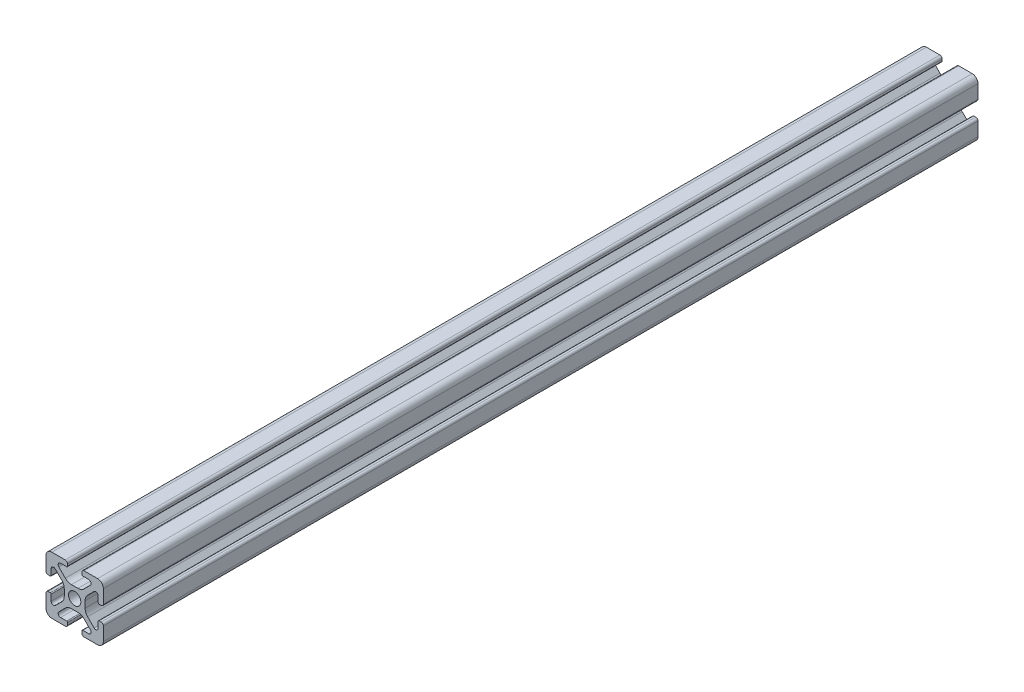
from build123d import *

# Parameters (mm, degrees)
SKETCH1_R           = 2.1463
BOSS_EXTRUDE1_DEPTH = 152.4


with BuildPart() as part:
    # Sketch1 → Boss-Extrude1 (new, symmetric)
    with BuildSketch(Plane.XY):
        with BuildLine():
            Line((-9.9949, 7.9883), (-9.9949, 3.2893))
            ThreePointArc((-9.9949, 3.2893), (-9.76427588, 2.73252412), (-9.2075, 2.5019))
            Line((-9.2075, 2.5019), (-8.4963, 2.5019))
            ThreePointArc((-8.4963, 2.5019), (-8.280773853, 2.591173853), (-8.1915, 2.8067))
            Line((-8.1915, 2.8067), (-8.1915, 4.9149))
            ThreePointArc((-8.1915, 4.9149), (-7.674065253, 5.689295824), (-6.760603096, 5.507596904))
            Line((-6.760603096, 5.507596904), (-4.505765747, 3.252759555))
            ThreePointArc((-4.505765747, 3.252759555), (-3.856054457, 2.280397894), (-3.627906192, 1.133419111))
            Line((-3.627906192, 1.133419111), (-3.627906192, -1.133419111))
            ThreePointArc((-3.627906192, -1.133419111), (-3.856054457, -2.280397894), (-4.505765747, -3.252759555))
            Line((-4.505765747, -3.252759555), (-6.760603096, -5.507596904))
            ThreePointArc((-6.760603096, -5.507596904), (-7.674065253, -5.689295824), (-8.1915, -4.9149))
            Line((-8.1915, -4.9149), (-8.1915, -2.8067))
            ThreePointArc((-8.1915, -2.8067), (-8.280773853, -2.591173853), (-8.4963, -2.5019))
            Line((-8.4963, -2.5019), (-9.2075, -2.5019))
            ThreePointArc((-9.2075, -2.5019), (-9.76427588, -2.73252412), (-9.9949, -3.2893))
            Line((-9.9949, -3.2893), (-9.9949, -7.9883))
            ThreePointArc((-9.9949, -7.9883), (-9.407180467, -9.407180467), (-7.9883, -9.9949))
            Line((-7.9883, -9.9949), (-3.2893, -9.9949))
            ThreePointArc((-3.2893, -9.9949), (-2.73252412, -9.76427588), (-2.5019, -9.2075))
            Line((-2.5019, -9.2075), (-2.5019, -8.4963))
            ThreePointArc((-2.5019, -8.4963), (-2.591173853, -8.280773853), (-2.8067, -8.1915))
            Line((-2.8067, -8.1915), (-4.9149, -8.1915))
            ThreePointArc((-4.9149, -8.1915), (-5.689295824, -7.674065253), (-5.507596904, -6.760603096))
            Line((-5.507596904, -6.760603096), (-3.252759555, -4.505765747))
            ThreePointArc((-3.252759555, -4.505765747), (-2.280397894, -3.856054457), (-1.133419111, -3.627906192))
            Line((-1.133419111, -3.627906192), (1.133419111, -3.627906192))
            ThreePointArc((1.133419111, -3.627906192), (2.280397894, -3.856054457), (3.252759555, -4.505765747))
            Line((3.252759555, -4.505765747), (5.507596904, -6.760603096))
            ThreePointArc((5.507596904, -6.760603096), (5.689295824, -7.674065253), (4.9149, -8.1915))
            Line((4.9149, -8.1915), (2.8067, -8.1915))
            ThreePointArc((2.8067, -8.1915), (2.591173853, -8.280773853), (2.5019, -8.4963))
            Line((2.5019, -8.4963), (2.5019, -9.2075))
            ThreePointArc((2.5019, -9.2075), (2.73252412, -9.76427588), (3.2893, -9.9949))
            Line((3.2893, -9.9949), (7.9883, -9.9949))
            ThreePointArc((7.9883, -9.9949), (9.407180467, -9.407180467), (9.9949, -7.9883))
            Line((9.9949, -7.9883), (9.9949, -3.2893))
            ThreePointArc((9.9949, -3.2893), (9.76427588, -2.73252412), (9.2075, -2.5019))
            Line((9.2075, -2.5019), (8.4963, -2.5019))
            ThreePointArc((8.4963, -2.5019), (8.280773853, -2.591173853), (8.1915, -2.8067))
            Line((8.1915, -2.8067), (8.1915, -4.9149))
            ThreePointArc((8.1915, -4.9149), (7.674065253, -5.689295824), (6.760603096, -5.507596904))
            Line((6.760603096, -5.507596904), (4.505765747, -3.252759555))
            ThreePointArc((4.505765747, -3.252759555), (3.856054457, -2.280397894), (3.627906192, -1.133419111))
            Line((3.627906192, -1.133419111), (3.627906192, 1.133419111))
            ThreePointArc((3.627906192, 1.133419111), (3.856054457, 2.280397894), (4.505765747, 3.252759555))
            Line((4.505765747, 3.252759555), (6.760603096, 5.507596904))
            ThreePointArc((6.760603096, 5.507596904), (7.674065253, 5.689295824), (8.1915, 4.9149))
            Line((8.1915, 4.9149), (8.1915, 2.8067))
            ThreePointArc((8.1915, 2.8067), (8.280773853, 2.591173853), (8.4963, 2.5019))
            Line((8.4963, 2.5019), (9.2075, 2.5019))
            ThreePointArc((9.2075, 2.5019), (9.76427588, 2.73252412), (9.9949, 3.2893))
            Line((9.9949, 3.2893), (9.9949, 7.9883))
            ThreePointArc((9.9949, 7.9883), (9.407180467, 9.407180467), (7.9883, 9.9949))
            Line((7.9883, 9.9949), (3.2893, 9.9949))
            ThreePointArc((3.2893, 9.9949), (2.73252412, 9.76427588), (2.5019, 9.2075))
            Line((2.5019, 9.2075), (2.5019, 8.4963))
            ThreePointArc((2.5019, 8.4963), (2.591173853, 8.280773853), (2.8067, 8.1915))
            Line((2.8067, 8.1915), (4.9149, 8.1915))
            ThreePointArc((4.9149, 8.1915), (5.689295824, 7.674065253), (5.507596904, 6.760603096))
            Line((5.507596904, 6.760603096), (3.252759555, 4.505765747))
            ThreePointArc((3.252759555, 4.505765747), (2.280397894, 3.856054457), (1.133419111, 3.627906192))
            Line((1.133419111, 3.627906192), (-1.133419111, 3.627906192))
            ThreePointArc((-1.133419111, 3.627906192), (-2.280397894, 3.856054457), (-3.252759555, 4.505765747))
            Line((-3.252759555, 4.505765747), (-5.507596904, 6.760603096))
            ThreePointArc((-5.507596904, 6.760603096), (-5.689295824, 7.674065253), (-4.9149, 8.1915))
            Line((-4.9149, 8.1915), (-2.8067, 8.1915))
            ThreePointArc((-2.8067, 8.1915), (-2.591173853, 8.280773853), (-2.5019, 8.4963))
            Line((-2.5019, 8.4963), (-2.5019, 9.2075))
            ThreePointArc((-2.5019, 9.2075), (-2.73252412, 9.76427588), (-3.2893, 9.9949))
            Line((-3.2893, 9.9949), (-7.9883, 9.9949))
            ThreePointArc((-7.9883, 9.9949), (-9.407180467, 9.407180467), (-9.9949, 7.9883))
        make_face()
        with Locations(Location((0, 0, 0), (0, 0, 180))):
            Circle(SKETCH1_R, mode=Mode.SUBTRACT)
    extrude(amount=BOSS_EXTRUDE1_DEPTH, both=True)


solid = part.part
